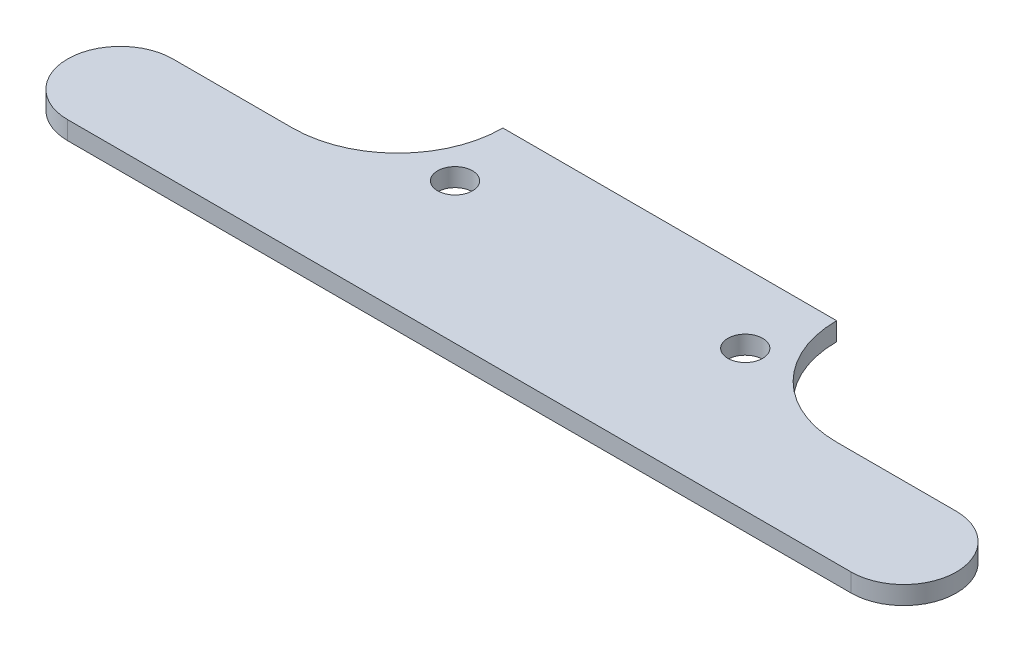
from build123d import *

# Parameters (mm, degrees)
SKETCH1_R           = 1.524
BOSS_EXTRUDE1_DEPTH = 1.6


with BuildPart() as part:
    # Sketch1 → Boss-Extrude1 (new body)
    with BuildSketch(Plane(origin=(0, 0, 0), x_dir=(1, 0, 0), z_dir=(0, 1, 0))):
        with BuildLine():
            Line((-23.8125, 4.60375), (-34.29, 4.60375))
            ThreePointArc((-34.29, 4.60375), (-38.89375, 0), (-34.29, -4.60375))
            Line((-34.29, -4.60375), (34.29, -4.60375))
            ThreePointArc((34.29, -4.60375), (38.89375, 0), (34.29, 4.60375))
            Line((34.29, 4.60375), (23.8125, 4.60375))
            ThreePointArc((23.8125, 4.60375), (17.301814312, 7.300564312), (14.605, 13.81125))
            Line((14.605, 13.81125), (-14.605, 13.81125))
            ThreePointArc((-14.605, 13.81125), (-17.301814312, 7.300564312), (-23.8125, 4.60375))
        make_face()
        with Locations(Location((12.7, 7.71525, 0), (0, 0, 270))):
            Circle(SKETCH1_R, mode=Mode.SUBTRACT)
        with Locations(Location((-12.7, 7.71525, 0), (0, 0, 270))):
            Circle(SKETCH1_R, mode=Mode.SUBTRACT)
    extrude(amount=BOSS_EXTRUDE1_DEPTH)


solid = part.part
